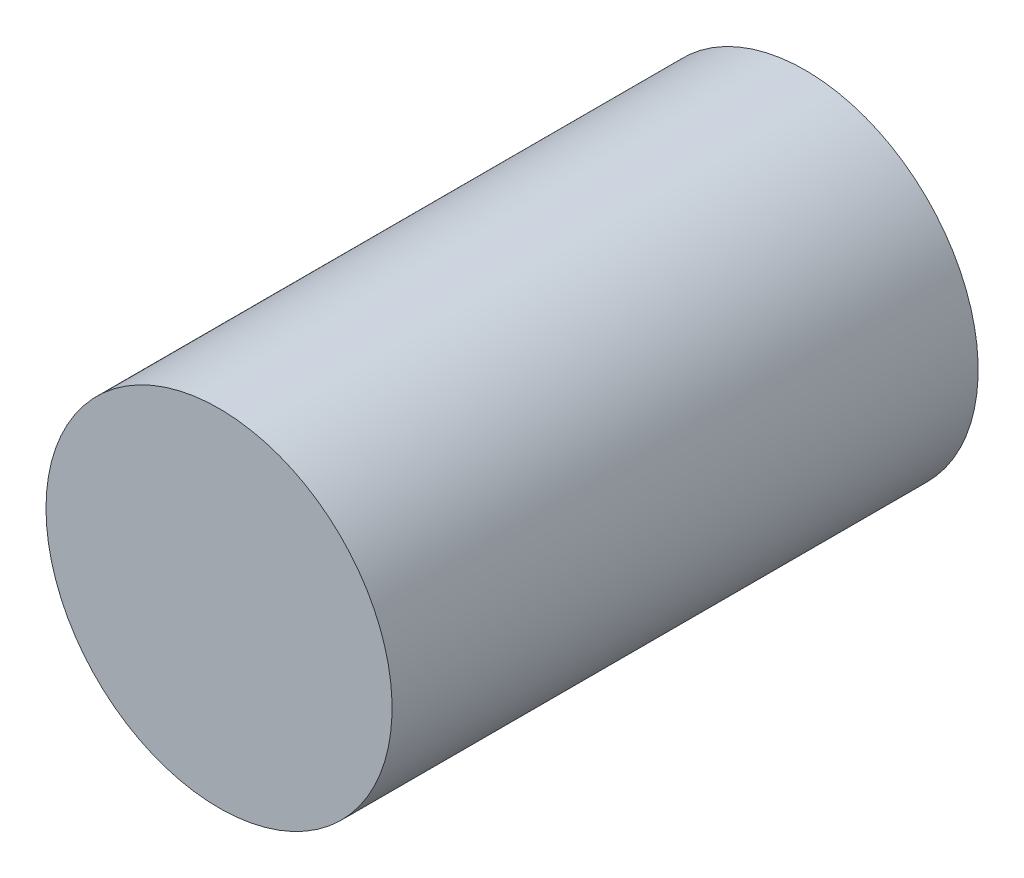
from build123d import *

# Parameters (mm, degrees)
SKETCH1_R      = 6.2
ENVELOPE_DEPTH = 21


with BuildPart() as part:
    # Sketch1 → Envelope (new body)
    with BuildSketch(Plane.XY):
        with Locations(Location((0, 0, 0), (0, 0, 180))):
            Circle(SKETCH1_R)
    extrude(amount=ENVELOPE_DEPTH)


solid = part.part
